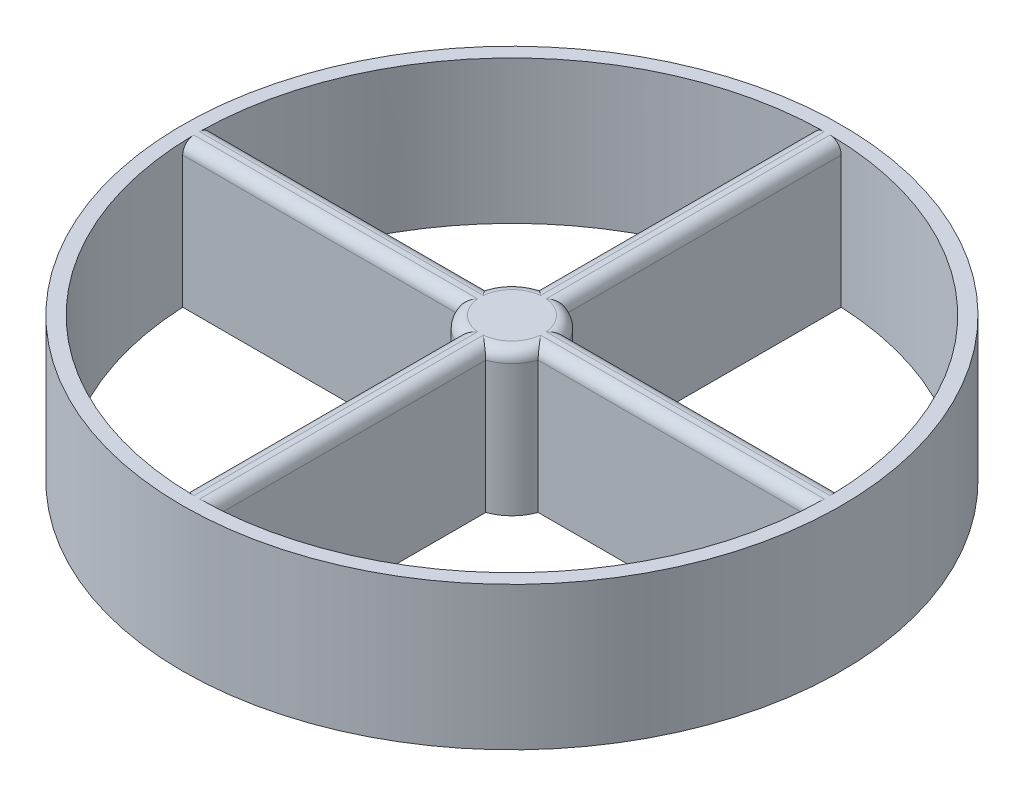
from build123d import *

# Parameters (mm, degrees)
SKETCH1_R           = 23
BOSS_EXTRUDE1_DEPTH = 10
FILLET1_R           = 0.8
SKETCH2_R           = 1.5
CUT_EXTRUDE1_DEPTH  = 6


with BuildPart() as part:
    # Sketch1 → Boss-Extrude1 (new body)
    with BuildSketch(Plane(origin=(0, 0, 0), x_dir=(1, 0, 0), z_dir=(0, 1, 0))):
        with Locations(Location((0, 0, 0), (0, 0, 270))):
            Circle(SKETCH1_R)
        with BuildLine():
            Line((-1, 21.977260976), (-1, 2.828427125))
            ThreePointArc((-1, 2.828427125), (-2.121320344, 2.121320344), (-2.828427125, 1))
            Line((-2.828427125, 1), (-21.977260976, 1))
            ThreePointArc((-21.977260976, 1), (-15.556349186, 15.556349186), (-1, 21.977260976))
        make_face(mode=Mode.SUBTRACT)
        with BuildLine():
            Line((1, 21.977260976), (1, 2.828427125))
            ThreePointArc((1, 2.828427125), (2.121320344, 2.121320344), (2.828427125, 1))
            Line((2.828427125, 1), (21.977260976, 1))
            ThreePointArc((21.977260976, 1), (15.556349186, 15.556349186), (1, 21.977260976))
        make_face(mode=Mode.SUBTRACT)
        with BuildLine():
            Line((-21.977260976, -1), (-2.828427125, -1))
            ThreePointArc((-2.828427125, -1), (-2.121320344, -2.121320344), (-1, -2.828427125))
            Line((-1, -2.828427125), (-1, -21.977260976))
            ThreePointArc((-1, -21.977260976), (-15.556349186, -15.556349186), (-21.977260976, -1))
        make_face(mode=Mode.SUBTRACT)
        with BuildLine():
            Line((1, -2.828427125), (1, -21.977260976))
            ThreePointArc((1, -21.977260976), (15.556349186, -15.556349186), (21.977260976, -1))
            Line((21.977260976, -1), (2.828427125, -1))
            ThreePointArc((2.828427125, -1), (2.121320344, -2.121320344), (1, -2.828427125))
        make_face(mode=Mode.SUBTRACT)
    extrude(amount=BOSS_EXTRUDE1_DEPTH)

    # Fillet1
    fillet1_edges = [part.edges().sort_by_distance(p)[0] for p in [
        (2.121320344, 10, -2.121320344),
        (12.40284405, 10, -1),
        (-2.121320344, 10, 2.121320344),
        (-12.40284405, 10, 1),
        (-1, 10, 12.40284405),
        (12.40284405, 10, 1),
        (2.121320344, 10, 2.121320344),
        (1, 10, 12.40284405),
        (-12.40284405, 10, -1),
        (-2.121320344, 10, -2.121320344),
        (-1, 10, -12.40284405),
        (1, 10, -12.40284405),
    ]]
    fillet(fillet1_edges, radius=FILLET1_R)

    # Sketch2 → Cut-Extrude1 (cut)
    with BuildSketch(Plane.XZ):
        with Locations(Location((0, 0, 0), (0, 0, 270))):
            Circle(SKETCH2_R)
    extrude(amount=-CUT_EXTRUDE1_DEPTH, mode=Mode.SUBTRACT)


solid = part.part
